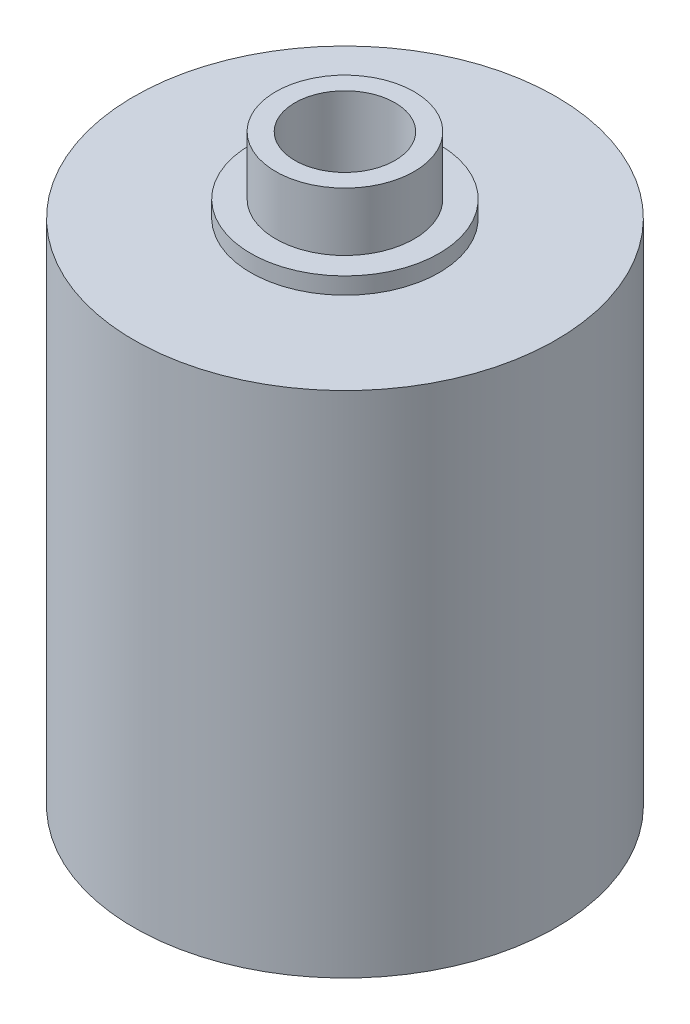
from build123d import *

# Parameters (mm, degrees)
SKETCH_2_W          = 15.2
SKETCH_2_H          = 15.2
CUT_EXTRUDE_1_DEPTH = 25


with BuildPart() as part:
    # Эскиз1 → Повернуть1 (revolve)
    with BuildSketch(Plane.XY, mode=Mode.PRIVATE) as revolve_1_sk:
        Polygon((0, 20), (3, 20), (3, 35), (4.15, 35), (4.15, 31.5), (5.65, 31.5), (5.65, 30.5), (12.65, 30.5), (12.65, 0), (0, 0), align=None)
    revolve(revolve_1_sk.sketch.rotate(Axis((0, 0, 0), (0, 1, 0)), 90), axis=Axis((0, 0, 0), (0, 1, 0)))

    # Эскиз2 → Вырез-Вытянуть1 (cut)
    with BuildSketch(Plane.XZ):
        Rectangle(SKETCH_2_W, SKETCH_2_H)
    extrude(amount=-CUT_EXTRUDE_1_DEPTH, mode=Mode.SUBTRACT)


solid = part.part
